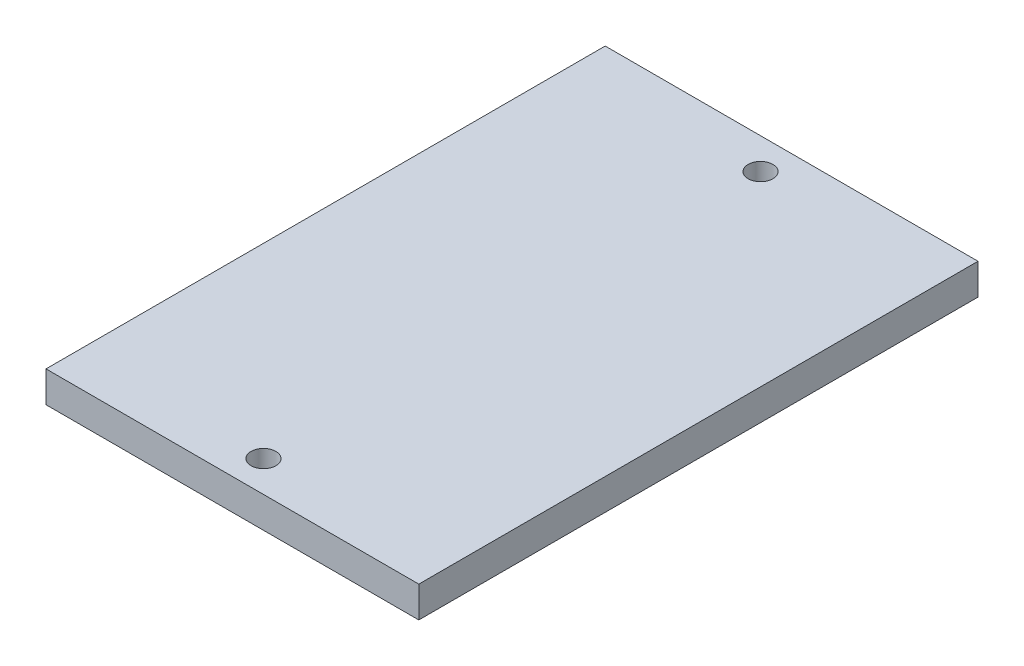
from build123d import *

# Parameters (mm, degrees)
SKETCH2_W           = 76.2
SKETCH2_H           = 114.3
BOSS_EXTRUDE1_DEPTH = 6.35
SKETCH6_R           = 2.54
CUT_EXTRUDE3_DEPTH  = 9.525


with BuildPart() as part:
    # Sketch2 → Boss-Extrude1 (new body)
    with BuildSketch(Plane(origin=(0, 0, 0), x_dir=(1, 0, 0), z_dir=(0, 1, 0))):
        with Locations((-1.871480339, 0)):
            Rectangle(SKETCH2_W, SKETCH2_H)
    extrude(amount=BOSS_EXTRUDE1_DEPTH)

    # Sketch6 → Cut-Extrude3 (cut)
    with BuildSketch(Plane(origin=(0, 6.35, 0), x_dir=(1, 0, 0), z_dir=(0, 1, 0))):
        with Locations(Location((-1.871480339, 50.8, 0), (0, 0, 270))):
            Circle(SKETCH6_R)
        with Locations(Location((-1.871480339, -50.8, 0), (0, 0, 270))):
            Circle(SKETCH6_R)
    extrude(amount=-CUT_EXTRUDE3_DEPTH, mode=Mode.SUBTRACT)


solid = part.part
